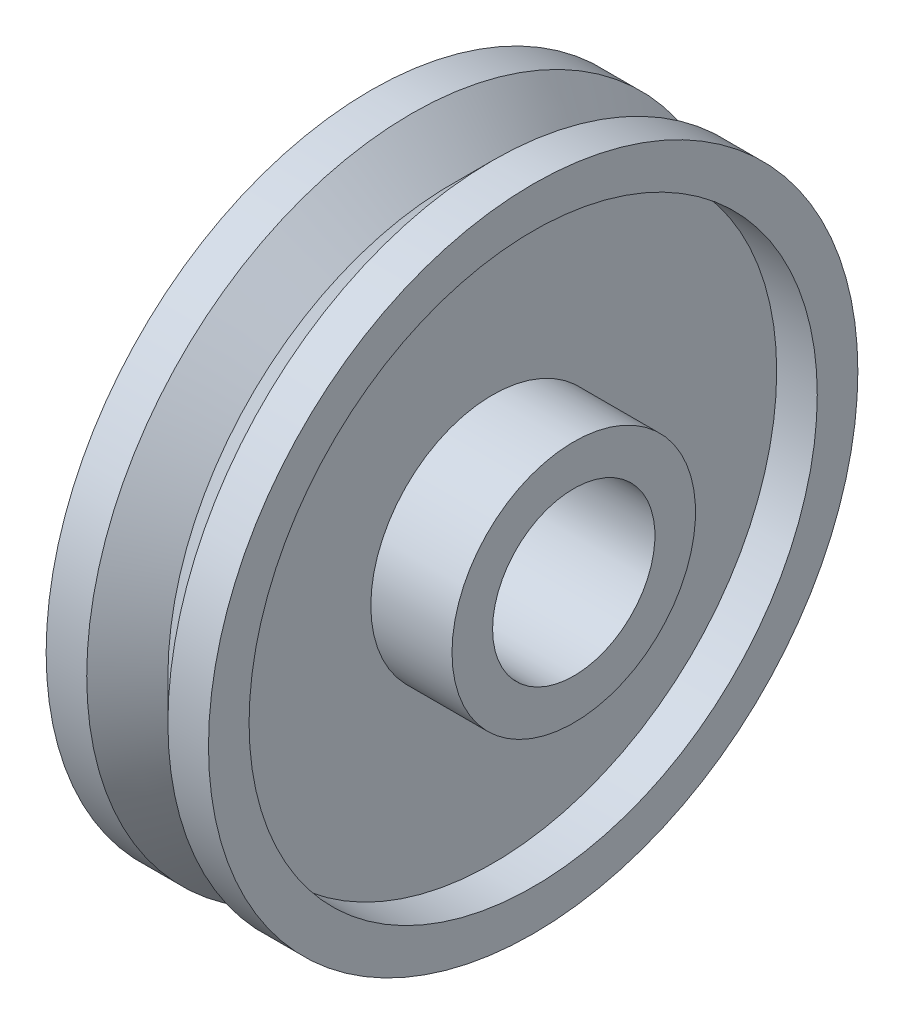
from build123d import *


with BuildPart() as part:
    # Sketch1 → Revolve1 (revolve)
    with BuildSketch(Plane.XY, mode=Mode.PRIVATE) as revolve1_sk:
        Polygon((0, 44.45), (0, 12.7), (19.05, 12.7), (19.05, 19.05), (6.35, 19.05), (6.35, 44.45), (12.7, 44.45), (12.7, 50.8), (6.35, 50.8), align=None)
        Polygon((-19.05, 12.7), (0, 12.7), (0, 44.45), (-6.35, 50.8), (-12.7, 50.8), (-12.7, 44.45), (-6.35, 44.45), (-6.35, 19.05), (-19.05, 19.05), align=None)
    revolve(revolve1_sk.sketch.rotate(Axis((-36.19513903, 0, 0), (1, 0, 0)), 90), axis=Axis((-36.19513903, 0, 0), (1, 0, 0)))


solid = part.part
